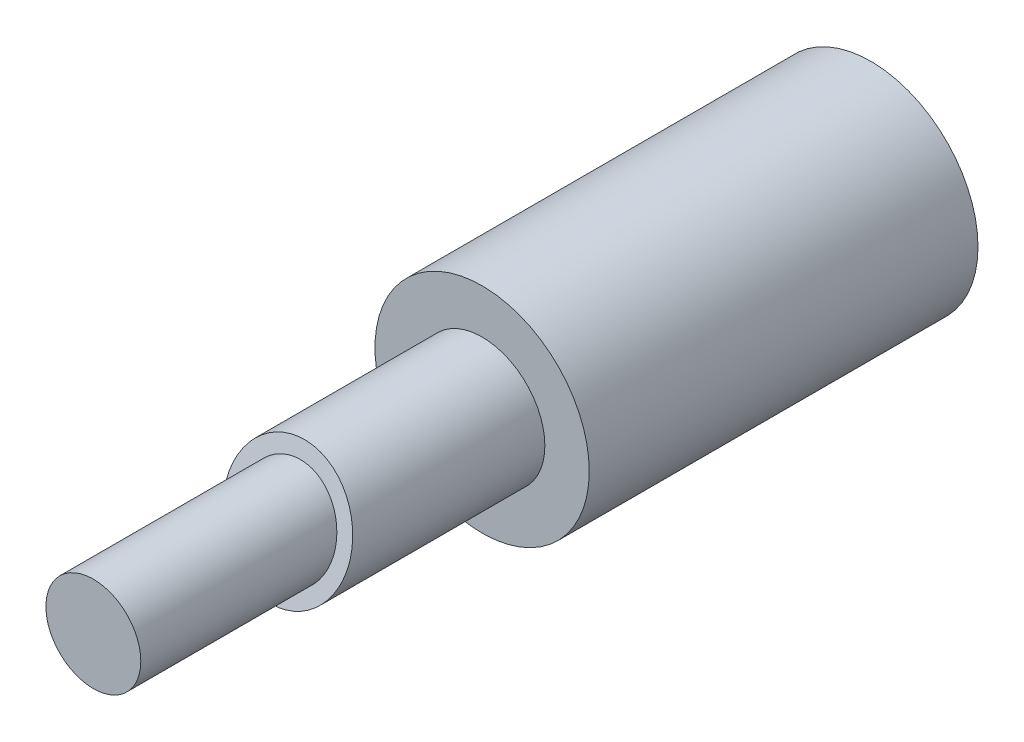
from build123d import *

# Parameters (mm, degrees)
DRAFT1_ANGLE = 15


with BuildPart() as part:
    # Sketch4 → Revolve1 (revolve)
    with BuildSketch(Plane(origin=(0, 0, 0), x_dir=(1, 0, 0), z_dir=(0, 1, 0))):
        Polygon((0, 101.6), (14, 101.6), (14, 50.8), (8.2, 50.8), (8.2, 25.4), (6.2, 25.4), (6.2, 0), (0, 0), align=None)
    revolve(axis=Axis((0, 0, 0), (0, 0, -1)))

    # Draft1
    draft1_faces = [part.faces().sort_by_distance(p)[0] for p in [
        (-7.968068976, 0, -25.4),
    ]]
    draft(draft1_faces, Plane.ZX, DRAFT1_ANGLE)


solid = part.part
